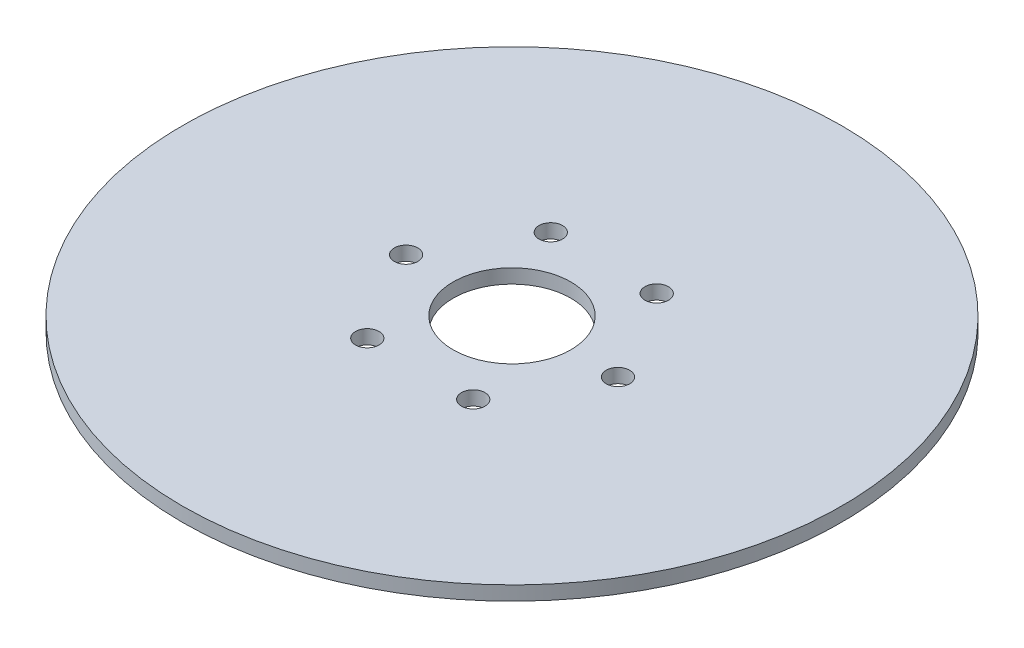
from build123d import *

# Parameters (mm, degrees)
SKETCH_1_R      = 70
SKETCH_1_R_2    = 12.5
SKETCH_1_R_3    = 2.5
EXTRUDE_1_DEPTH = 3


with BuildPart() as part:
    # 草图1 → 凸台-拉伸1 (new body)
    with BuildSketch(Plane(origin=(0, 0, 0), x_dir=(1, 0, 0), z_dir=(0, 1, 0))):
        with Locations(Location((0, 0, 0), (0, 0, 270))):
            Circle(SKETCH_1_R)
        with Locations(Location((0, 0, 0), (0, 0, 270))):
            Circle(SKETCH_1_R_2, mode=Mode.SUBTRACT)
        with Locations(Location((22.5, 0, 0), (0, 0, 270))):
            Circle(SKETCH_1_R_3, mode=Mode.SUBTRACT)
        with Locations(Location((11.25, -19.485571585, 0), (0, 0, 270))):
            Circle(SKETCH_1_R_3, mode=Mode.SUBTRACT)
        with Locations(Location((-11.25, -19.485571585, 0), (0, 0, 270))):
            Circle(SKETCH_1_R_3, mode=Mode.SUBTRACT)
        with Locations(Location((-22.5, 0, 0), (0, 0, 270))):
            Circle(SKETCH_1_R_3, mode=Mode.SUBTRACT)
        with Locations(Location((-11.25, 19.485571585, 0), (0, 0, 270))):
            Circle(SKETCH_1_R_3, mode=Mode.SUBTRACT)
        with Locations(Location((11.25, 19.485571585, 0), (0, 0, 270))):
            Circle(SKETCH_1_R_3, mode=Mode.SUBTRACT)
    extrude(amount=EXTRUDE_1_DEPTH)


solid = part.part
